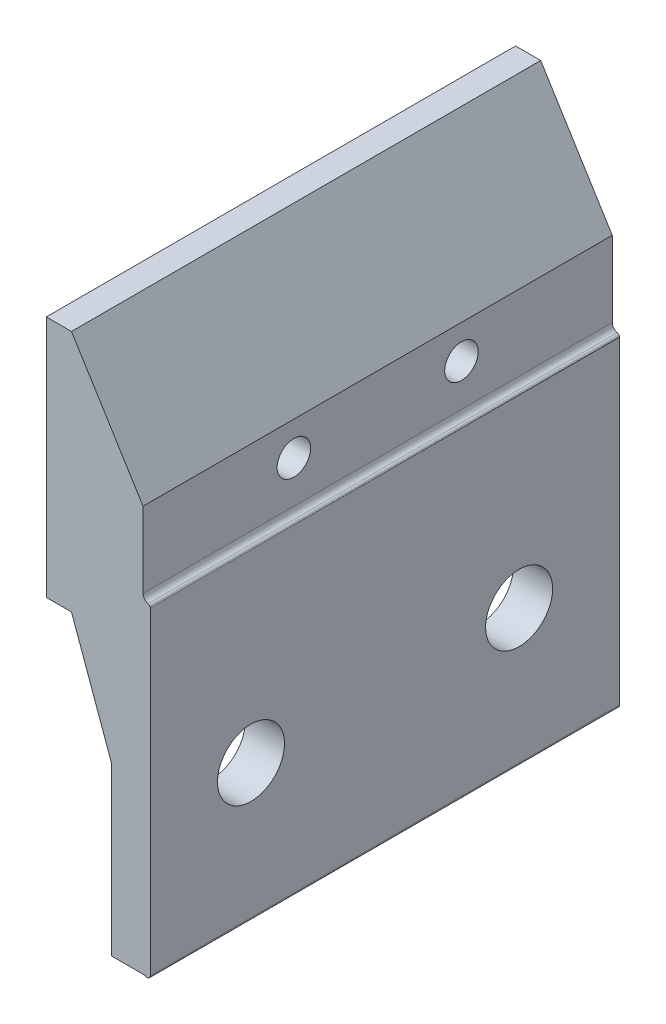
from build123d import *

# Parameters (mm, degrees)
EXTRUDE_2_DEPTH          = 28
CUT_EXTRUDE_3_DEPTH      = 55.695457471
CUT_EXTRUDE_3_DEPTH_BACK = 55.695457471
SKETCH_2_R               = 1
SKETCH_2_R_2             = 2


with BuildPart() as part:
    # 草图1 → 凸台-拉伸2 (new body)
    with BuildSketch(Plane.XY):
        with BuildLine():
            Line((-15.852639514, -15.493363478), (-14.352639514, -15.493363478))
            Line((-14.352639514, -15.493363478), (-10.082641686, -22.391510936))
            Line((-10.082641686, -22.391510936), (-10.082641686, -26.891510936))
            ThreePointArc((-10.082641686, -26.891510936), (-9.999818758, -27.135229432), (-9.78564816, -27.27802053))
            ThreePointArc((-9.78564816, -27.27802053), (-9.692275449, -27.33339509), (-9.641586108, -27.429391944))
            Line((-9.641586108, -27.429391944), (-9.641586108, -46.429391944))
            ThreePointArc((-9.641586108, -46.429391944), (-9.760568765, -46.612247597), (-9.975948009, -46.577536736))
            Line((-9.975948009, -46.577536736), (-10.975948009, -46.577536736))
            Line((-10.975948009, -46.577536736), (-11.975948009, -46.577536736))
            Line((-11.975948009, -46.577536736), (-11.975948009, -36.577536736))
            Line((-11.975948009, -36.577536736), (-14.352639514, -29.993363478))
            Line((-14.352639514, -29.993363478), (-15.852639514, -29.993363478))
            Line((-15.852639514, -29.993363478), (-15.852639514, -15.493363478))
        make_face()
    extrude(amount=EXTRUDE_2_DEPTH)

    # 草图2 → 切除-拉伸3 (cut, two sides: drawn at the far end of the back side and taken through both)
    with BuildSketch(Plane(origin=(-10.082641686, 0, 0), x_dir=(0, 0, -1), z_dir=(1, 0, 0)).offset(-CUT_EXTRUDE_3_DEPTH_BACK)):
        with Locations(Location((-19, -24.391510936, 0), (0, 0, 90))):
            Circle(SKETCH_2_R)
        with Locations(Location((-22, -38.429391944, 0), (0, 0, 90))):
            Circle(SKETCH_2_R_2)
        with Locations(Location((-6, -38.429391944, 0), (0, 0, 90))):
            Circle(SKETCH_2_R_2)
        with Locations(Location((-9, -24.391510936, 0), (0, 0, 90))):
            Circle(SKETCH_2_R)
    extrude(amount=CUT_EXTRUDE_3_DEPTH + CUT_EXTRUDE_3_DEPTH_BACK, mode=Mode.SUBTRACT)


solid = part.part
